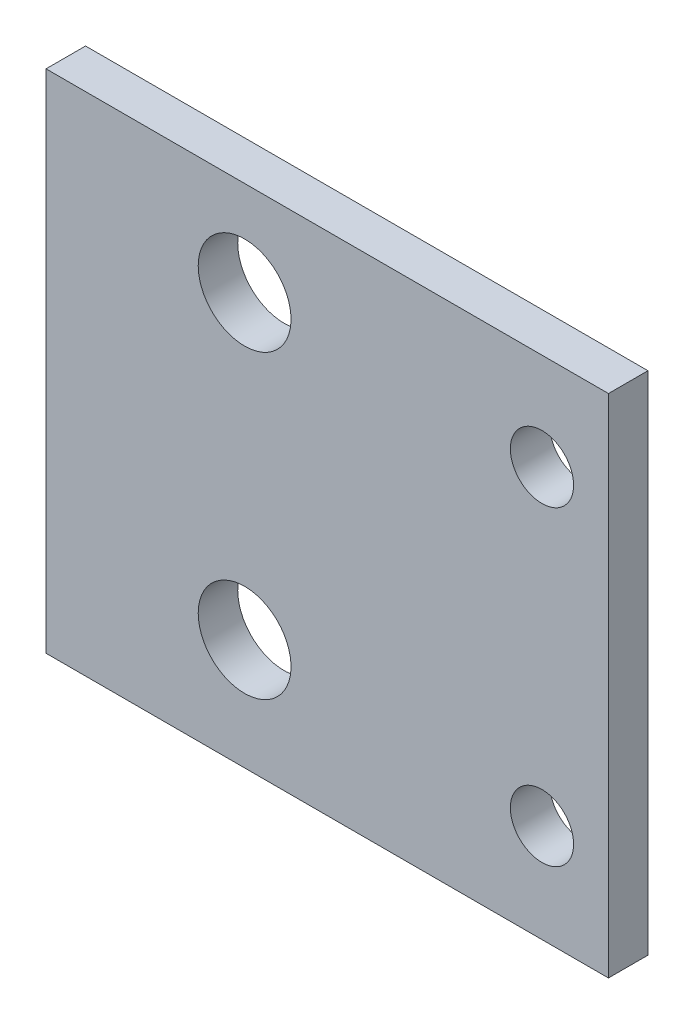
from build123d import *

# Parameters (mm, degrees)
SKETCH1_W            = 40
SKETCH1_H            = 36
BOSS_EXTRUDE1_DEPTH  = 2.81
M4_CLEARANCE_HOLE1_D = 4.5
M6_CLEARANCE_HOLE1_D = 6.6


with BuildPart() as part:
    # Sketch1 → Boss-Extrude1 (new body)
    with BuildSketch(Plane.XY):
        Rectangle(SKETCH1_W, SKETCH1_H)
    extrude(amount=BOSS_EXTRUDE1_DEPTH)

    # M4 Clearance Hole1 (through all)
    with Locations(Plane(origin=(0, 0, 0), x_dir=(-1, 0, 0), z_dir=(0, 0, -1))):
        with Locations((-15.273020567, -10.999999997), (-15.273020567, 11.110907406)):
            Hole(M4_CLEARANCE_HOLE1_D / 2)

    # M6 Clearance Hole1 (through all)
    with Locations(Plane(origin=(0, 0, 0), x_dir=(-1, 0, 0), z_dir=(0, 0, -1))):
        with Locations((5.877074643, -10.111576322), (5.877074643, 11.282650508)):
            Hole(M6_CLEARANCE_HOLE1_D / 2)


solid = part.part
